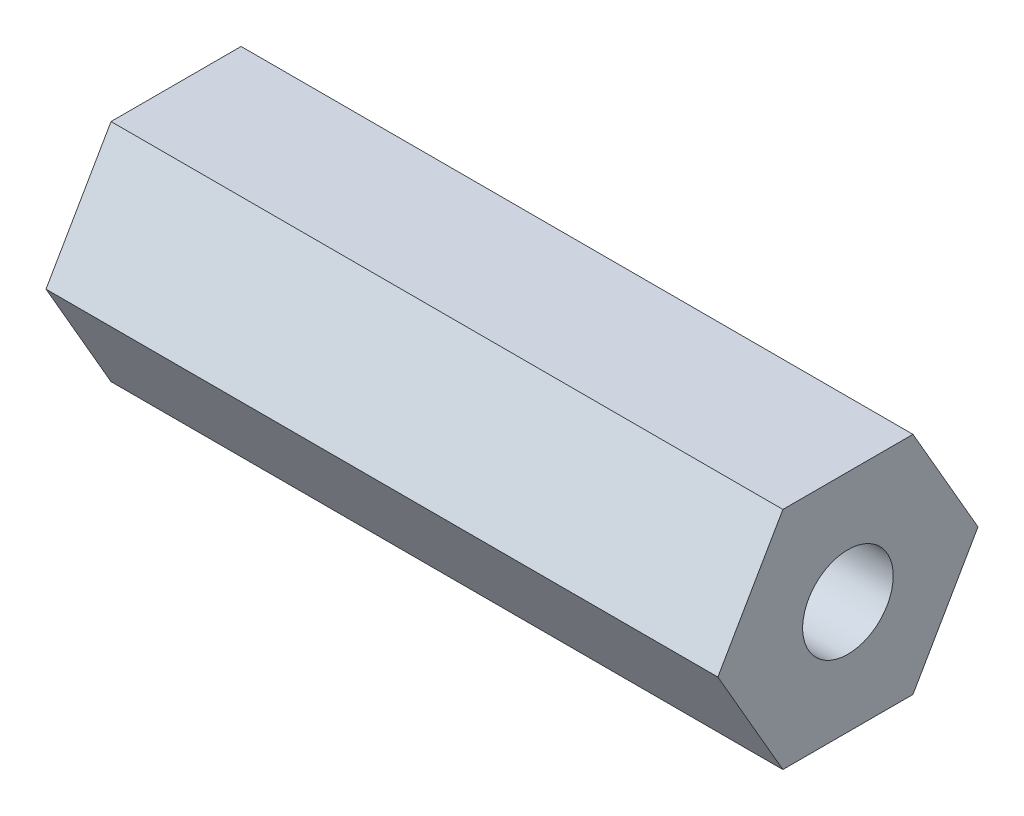
from build123d import *

# Parameters (mm, degrees)
BOSS_EXTRUDE1_DEPTH     = 18.937499939
F_1_4_20_TAPPED_HOLE1_D = 5.1054


with BuildPart() as part:
    # Sketch1 → Boss-Extrude1 (new, symmetric)
    with BuildSketch(Plane(origin=(0, 0, 0), x_dir=(0, 0, -1), z_dir=(1, 0, 0))):
        Polygon((7.332348419, 0), (3.666174209, 6.35), (-3.666174209, 6.35), (-7.332348419, 0), (-3.666174209, -6.35), (3.666174209, -6.35), align=None)
    extrude(amount=BOSS_EXTRUDE1_DEPTH, both=True)

    # 1/4-20 Tapped Hole1 (through all)
    with Locations(Plane(origin=(18.937499939, 0, 0), x_dir=(0, 0, -1), z_dir=(1, 0, 0))):
        with Locations((0, 0)):
            Hole(F_1_4_20_TAPPED_HOLE1_D / 2)


solid = part.part
